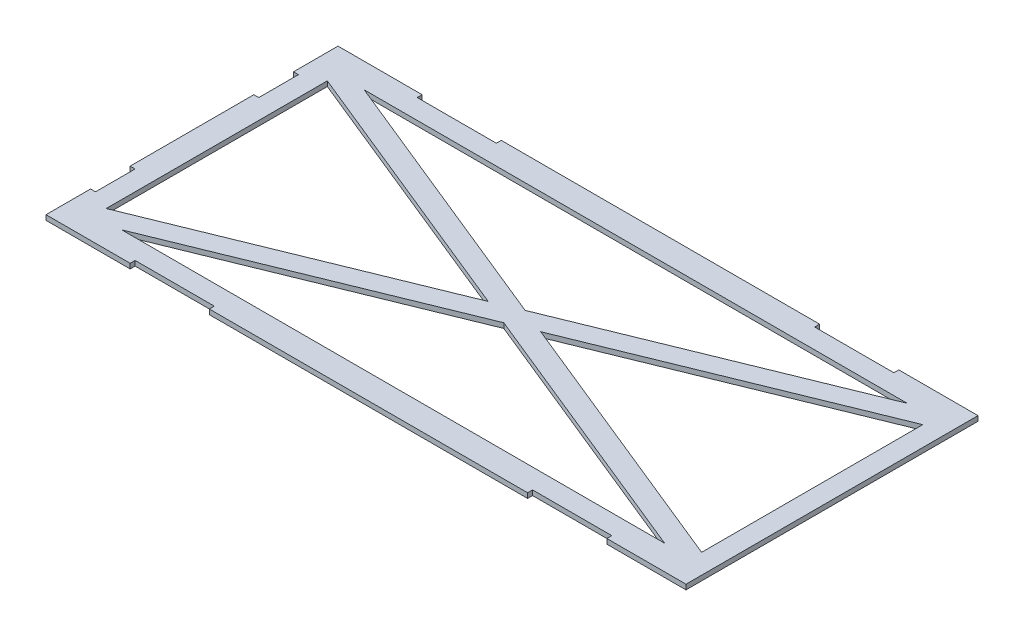
from build123d import *

# Parameters (mm, degrees)
BOSS_EXTRUDE3_DEPTH = 3.175


with BuildPart() as part:
    # Sketch1 → Boss-Extrude3 (new body)
    with BuildSketch(Plane(origin=(0, 0, 0), x_dir=(1, 0, 0), z_dir=(0, 1, 0))):
        Polygon((-56.010613502, -81.441915492), (-56.010613502, -84.616915492), (148.179986498, -84.616915492), (148.179986498, -81.441915492), (198.979986498, -81.441915492), (198.979986498, -84.616915492), (249.779986498, -84.616915492), (249.779986498, -81.441915492), (249.779986498, 99.533084508), (249.779986498, 102.708084508), (198.979986498, 102.708084508), (198.979986498, 99.533084508), (148.179986498, 99.533084508), (148.179986498, 102.708084508), (-56.010613502, 102.708084508), (-56.010613502, 99.533084508), (-106.810613502, 99.533084508), (-106.810613502, 102.708084508), (-157.610613502, 102.708084508), (-160.785613502, 102.708084508), (-160.785613502, 99.533084508), (-160.785613502, 74.133084508), (-157.610613502, 74.133084508), (-157.610613502, 48.733084508), (-160.785613502, 48.733084508), (-160.785613502, -30.641915492), (-157.610613502, -30.641915492), (-157.610613502, -56.041915492), (-160.785613502, -56.041915492), (-160.785613502, -81.441915492), (-160.785613502, -84.616915492), (-157.610613502, -84.616915492), (-106.810613502, -84.616915492), (-106.810613502, -81.441915492), align=None)
        Polygon((46.084686498, 15.902033442), (220.245025597, 86.833084508), (-128.0756526, 86.833084508), align=None, mode=Mode.SUBTRACT)
        Polygon((-144.910613502, -61.885466558), (29.249725597, 9.045584508), (-144.910613502, 79.976635573), align=None, mode=Mode.SUBTRACT)
        Polygon((-128.0756526, -68.741915492), (46.084686498, 2.189135573), (220.245025597, -68.741915492), align=None, mode=Mode.SUBTRACT)
        Polygon((62.9196474, 9.045584508), (237.079986498, -61.885466558), (237.079986498, 79.976635573), align=None, mode=Mode.SUBTRACT)
    extrude(amount=BOSS_EXTRUDE3_DEPTH)


solid = part.part
